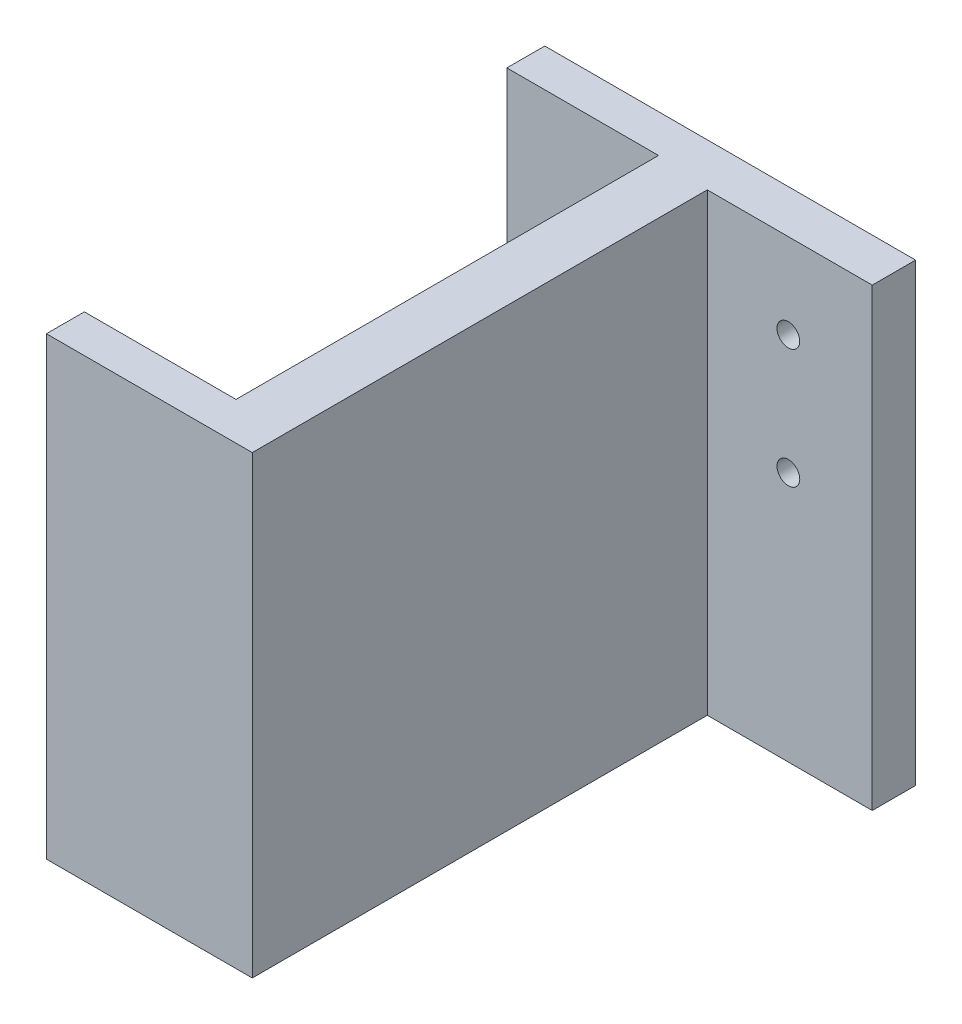
from build123d import *

# Parameters (mm, degrees)
BOSS_EXTRUDE1_DEPTH = 30
BOSS_EXTRUDE3_DEPTH = 10
SKETCH4_R           = 0.75
CUT_EXTRUDE1_DEPTH  = 10


with BuildPart() as part:
    # Sketch1 → Boss-Extrude1 (new body)
    with BuildSketch(Plane(origin=(0, 0, 0), x_dir=(1, 0, 0), z_dir=(0, 1, 0))):
        Polygon((0, 0), (0, 32.857142857), (14.446341209, 32.857142857), (14.446341209, 30), (3.571428571, 30), (3.571428571, 0), align=None)
    extrude(amount=BOSS_EXTRUDE1_DEPTH)

    # Sketch3 → Boss-Extrude3 (add)
    with BuildSketch(Plane.ZY):
        Polygon((-30.357142857, 0), (-32.857142857, 0), (-32.857142857, 30), (-30.357142857, 30), (-30.357142857, 27.5), (-30.357142857, 2.5), (-2.5, 2.5), (-2.5, 27.5), (-2.5, 30), (0, 30), (0, 0), (-2.5, 0), align=None)
    extrude(amount=BOSS_EXTRUDE3_DEPTH)

    # Sketch4 → Cut-Extrude1 (cut)
    with BuildSketch(Plane.XY.offset(-30)):
        with Locations((8.91712718, 24.396309317)):
            Circle(SKETCH4_R)
        with Locations((8.91712718, 16.526309317)):
            Circle(SKETCH4_R)
    extrude(amount=-CUT_EXTRUDE1_DEPTH, mode=Mode.SUBTRACT)


solid = part.part
